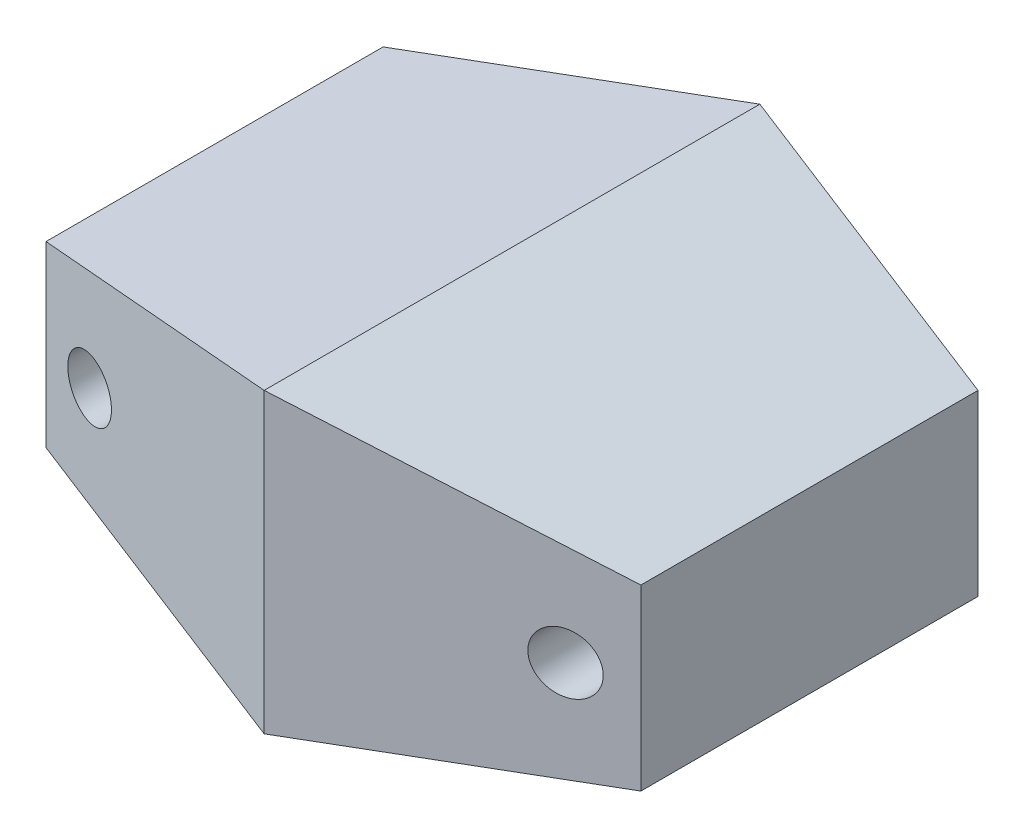
from build123d import *

# Parameters (mm, degrees)
SKETCH1_W               = 60
SKETCH1_H               = 30
BOSS_EXTRUDE1_DEPTH     = 50
CUT_EXTRUDE1_DEPTH      = 50
CUT_EXTRUDE2_DEPTH      = 61.207972894
CUT_EXTRUDE2_DEPTH_BACK = 61.207972894
CUT_EXTRUDE4_DEPTH      = 61.207972894
CUT_EXTRUDE4_DEPTH_BACK = 61.207972894
SKETCH5_R               = 3


with BuildPart() as part:
    # Sketch1 → Boss-Extrude1 (new body)
    with BuildSketch(Plane.XY):
        Rectangle(SKETCH1_W, SKETCH1_H)
    extrude(amount=BOSS_EXTRUDE1_DEPTH)

    # Sketch2 → Cut-Extrude1 (cut)
    with BuildSketch(Plane.XY.offset(50)):
        Polygon((-30, 9), (0, 15), (-30, 15), align=None)
        Polygon((30, 15), (0, 15), (30, 9), align=None)
        Polygon((0, -15), (-30, -9), (-30, -15), align=None)
        Polygon((30, -15), (30, -9), (0, -15), align=None)
    extrude(amount=-CUT_EXTRUDE1_DEPTH, mode=Mode.SUBTRACT)

    # Sketch4 → Cut-Extrude2 (cut, two sides: drawn at the far end of the back side and taken through both)
    with BuildSketch(Plane(origin=(0, 0, 0), x_dir=(1, 0, 0), z_dir=(0, 1, 0)).offset(-CUT_EXTRUDE2_DEPTH_BACK)):
        Polygon((-30, 0), (0, 0), (-30, -8), align=None)
        Polygon((30, 0), (30, -8), (0, 0), align=None)
        Polygon((30, -50), (0, -50), (30, -42), align=None)
        Polygon((-30, -42), (-30, -50), (0, -50), align=None)
    extrude(amount=CUT_EXTRUDE2_DEPTH + CUT_EXTRUDE2_DEPTH_BACK, mode=Mode.SUBTRACT)

    # Sketch5 → Cut-Extrude4 (cut, two sides: drawn at the far end of the back side and taken through both)
    with BuildSketch(Plane.XY.offset(-CUT_EXTRUDE4_DEPTH_BACK)):
        with Locations((-24, 0)):
            Circle(SKETCH5_R)
        with Locations((24, 0)):
            Circle(SKETCH5_R)
    extrude(amount=CUT_EXTRUDE4_DEPTH + CUT_EXTRUDE4_DEPTH_BACK, mode=Mode.SUBTRACT)


solid = part.part
